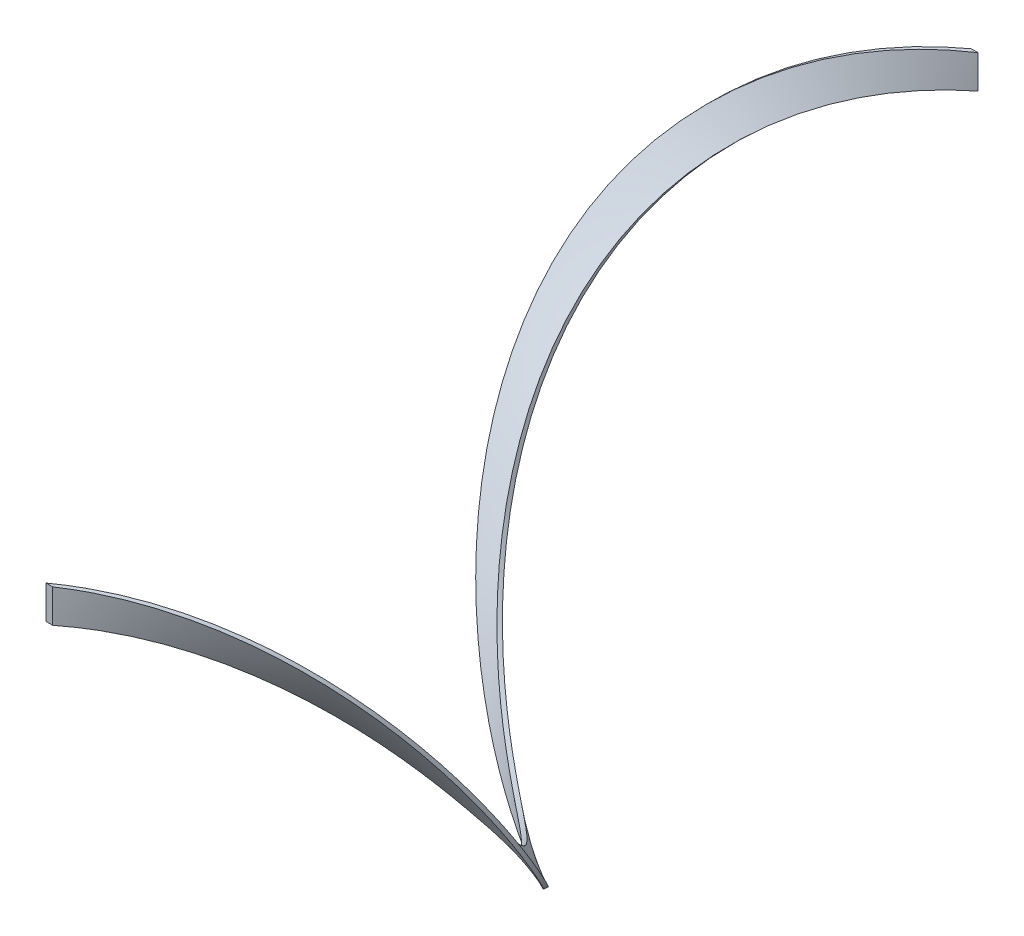
from build123d import *

# Parameters (mm, degrees)
SWEEP1_PITCH       = 833
SWEEP1_HEIGHT      = 833
SWEEP1_RADIUS      = 190.5
SWEEP1_START_ANGLE = -180
SKETCH2_W          = 6
SKETCH2_H          = 30


with BuildPart() as part:
    # Sweep1: sweep along a helix
    with BuildLine() as sweep1_path:
        add(Helix(SWEEP1_PITCH, SWEEP1_HEIGHT, SWEEP1_RADIUS, center=(0, 0, 0), direction=(0, 0, 1), mode=Mode.PRIVATE).rotate(Axis((0, 0, 0), (0, 0, 1)), SWEEP1_START_ANGLE))
    # Sketch2 → Sweep1 (sweep)
    with BuildSketch(Plane.XY):
        with Locations((0, 175.476376488)):
            Rectangle(SKETCH2_W, SKETCH2_H)
    sweep(path=sweep1_path.line, is_frenet=True)


solid = part.part
